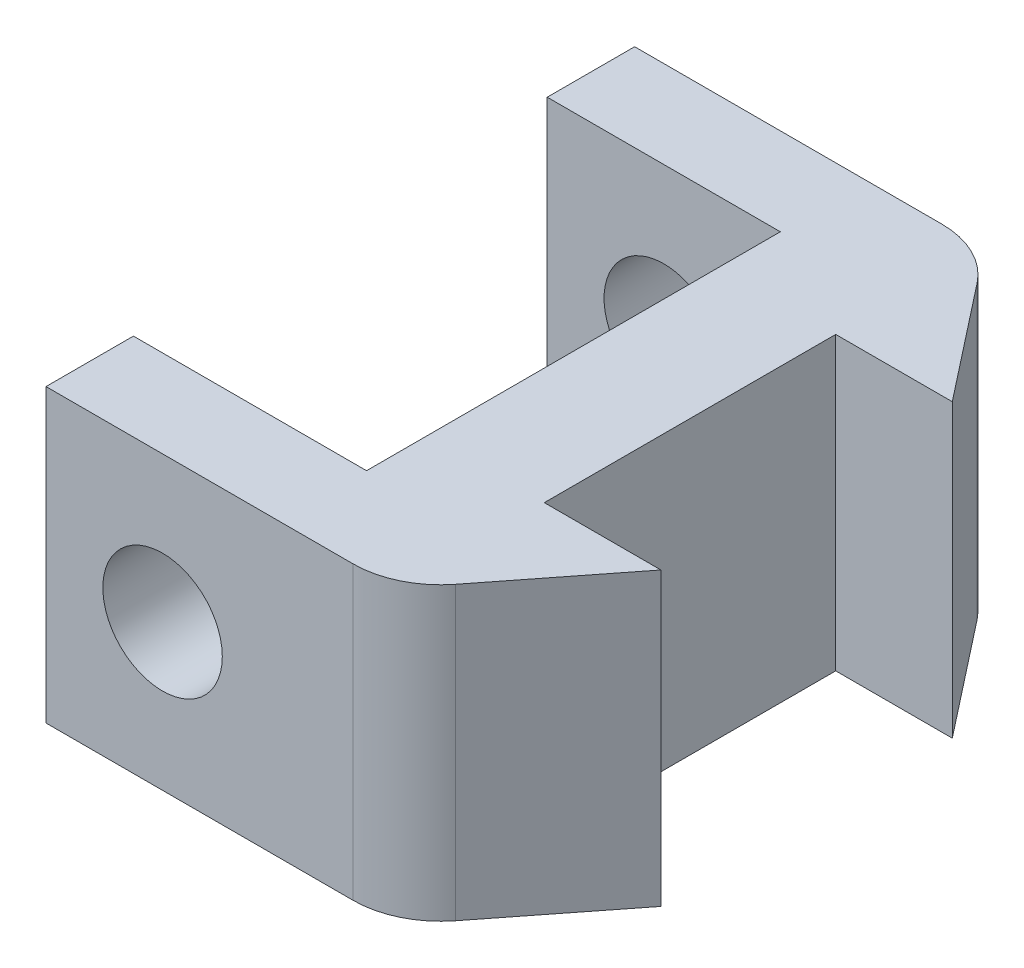
from build123d import *

# Parameters (mm, degrees)
BOSS_EXTRUDE1_DEPTH     = 10
CUT_EXTRUDE1_DEPTH      = 21.780760333
CUT_EXTRUDE1_DEPTH_BACK = 21.780760333
BOSS_EXTRUDE2_DEPTH     = 10
FILLET1_R               = 3


with BuildPart() as part:
    # Sketch1 → Boss-Extrude1 (new body)
    with BuildSketch(Plane(origin=(0, 0, 0), x_dir=(1, 0, 0), z_dir=(0, 1, 0))):
        Polygon((-6, -10.1), (6, -10.1), (6, 10.1), (-6, 10.1), (-6, 7.1), (2, 7.1), (2, -7.1), (-6, -7.1), align=None)
    extrude(amount=BOSS_EXTRUDE1_DEPTH)

    # Sketch2 → Cut-Extrude1 (cut, two sides: drawn at the far end of the back side and taken through both)
    with BuildSketch(Plane.XY.offset(-7.1).offset(-CUT_EXTRUDE1_DEPTH_BACK)):
        with BuildLine():
            ThreePointArc((-3.280624847, 6.600781059), (-3.600781059, 3.719375153), (-0.719375153, 3.399218941))
            Line((-0.719375153, 3.399218941), (-3.280624847, 6.600781059))
        make_face()
        with BuildLine():
            Line((-3.280624847, 6.600781059), (-0.719375153, 3.399218941))
            ThreePointArc((-0.719375153, 3.399218941), (-0.152328366, 4.111963102), (0.05, 5))
            ThreePointArc((0.05, 5), (-1.111963102, 6.847671634), (-3.280624847, 6.600781059))
        make_face()
    extrude(amount=CUT_EXTRUDE1_DEPTH + CUT_EXTRUDE1_DEPTH_BACK, mode=Mode.SUBTRACT)

    # Sketch3 → Boss-Extrude2 (add)
    with BuildSketch(Plane(origin=(0, 10, 0), x_dir=(1, 0, 0), z_dir=(0, 1, 0))):
        Polygon((10, 5), (6, 10.1), (6, 5), align=None)
        Polygon((6, -10.1), (10, -5), (6, -5), align=None)
    extrude(amount=-BOSS_EXTRUDE2_DEPTH)

    # Fillet1
    fillet1_edges = [part.edges().sort_by_distance(p)[0] for p in [
        (6, 5, -10.1),
        (6, 5, 10.1),
    ]]
    fillet(fillet1_edges, radius=FILLET1_R)


solid = part.part
